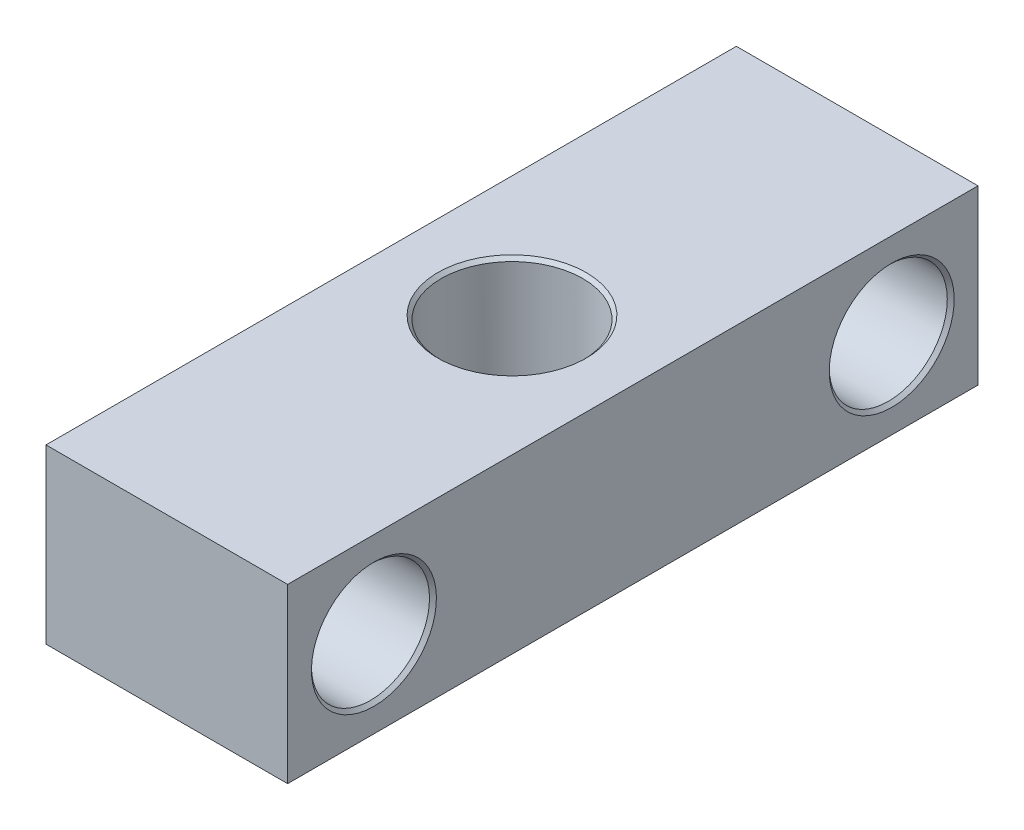
from build123d import *

# Parameters (mm, degrees)
SCHIZZO1_W                   = 35
SCHIZZO1_H                   = 25
ESTRUSIONE_ESTRUSIONE1_DEPTH = 50
SCHIZZO2_R                   = 10.25
TAGLIO_ESTRUSIONE1_DEPTH     = 100
SCHIZZO3_R                   = 8.55
TAGLIO_ESTRUSIONE3_DEPTH     = 63.299678972
SMUSSO1_SIZE                 = 0.5


with BuildPart() as part:
    # Schizzo1 → Estrusione-Estrusione1 (new, symmetric)
    with BuildSketch(Plane.XY):
        Rectangle(SCHIZZO1_W, SCHIZZO1_H)
    extrude(amount=ESTRUSIONE_ESTRUSIONE1_DEPTH, both=True)

    # Schizzo2 → Taglio-Estrusione1 (cut)
    with BuildSketch(Plane(origin=(0, 12.5, 0), x_dir=(1, 0, 0), z_dir=(0, 1, 0))):
        with Locations(Location((0, 0, 0), (0, 0, 270))):
            Circle(SCHIZZO2_R)
    extrude(amount=-TAGLIO_ESTRUSIONE1_DEPTH, mode=Mode.SUBTRACT)

    # Schizzo3 → Taglio-Estrusione3 (cut, through all)
    with BuildSketch(Plane(origin=(17.5, 0, 0), x_dir=(0, 0, -1), z_dir=(1, 0, 0))):
        with Locations(Location((37.5, 0, 0), (0, 0, 90))):
            Circle(SCHIZZO3_R)
        with Locations(Location((-37.5, 0, 0), (0, 0, 90))):
            Circle(SCHIZZO3_R)
    extrude(amount=-TAGLIO_ESTRUSIONE3_DEPTH, mode=Mode.SUBTRACT)

    # Smusso1
    smusso1_edges = [part.edges().sort_by_distance(p)[0] for p in [
        (0, -12.5, -10.25),
        (0, 12.5, -10.25),
        (-17.5, -8.55, -37.5),
        (17.5, -8.55, -37.5),
        (-17.5, -8.55, 37.5),
        (17.5, -8.55, 37.5),
    ]]
    chamfer(smusso1_edges, length=SMUSSO1_SIZE)


solid = part.part
